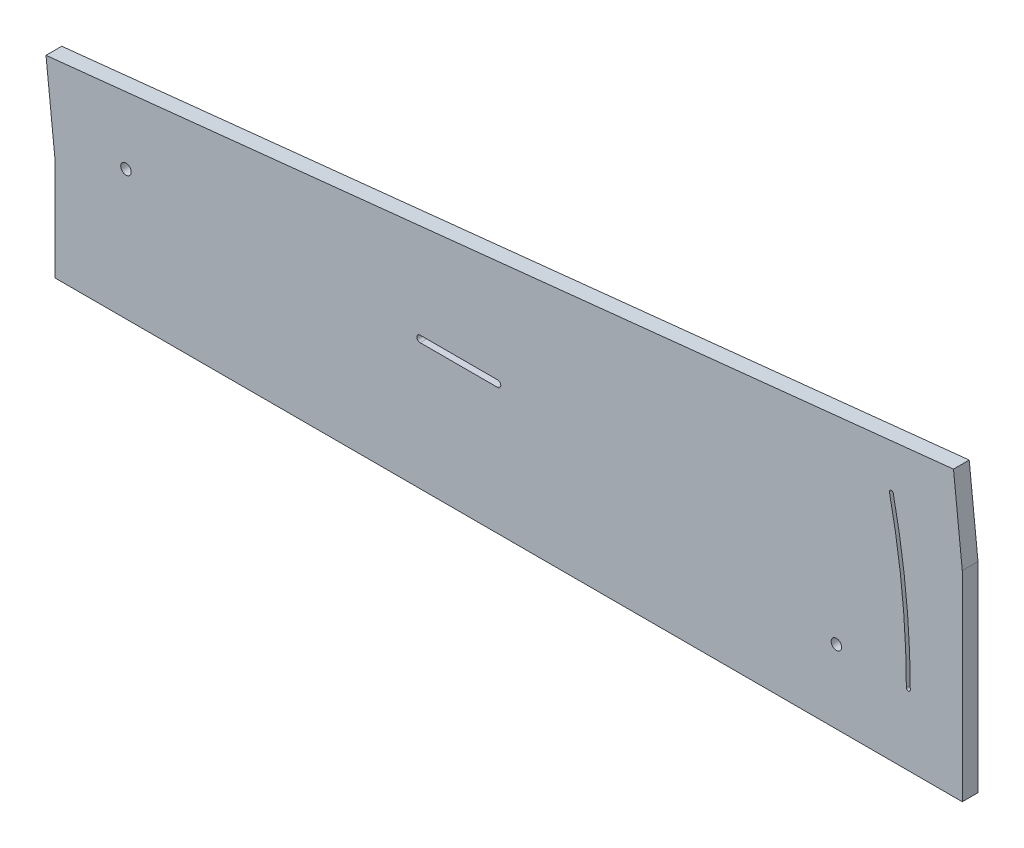
from build123d import *

# Parameters (mm, degrees)
BOSS_EXTRUDE1_DEPTH = 19.05
SKETCH8_R           = 6.35
CUT_EXTRUDE3_DEPTH  = 1152.453768969
CUT_EXTRUDE4_DEPTH  = 1152.453768969
SKETCH10_R          = 6.35
CUT_EXTRUDE5_DEPTH  = 1152.453768969


with BuildPart() as part:
    # Sketch1 → Boss-Extrude1 (new body)
    with BuildSketch(Plane.XY):
        Polygon((-10.620091868, 228.043424569), (1088.227150324, 343.536923634), (1098.847242192, 242.493499064), (1098.847242192, 0), (0, 0), (0, 127), align=None)
    extrude(amount=BOSS_EXTRUDE1_DEPTH)

    # Sketch8 → Cut-Extrude3 (cut, through all)
    with BuildSketch(Plane.XY.offset(19.05)):
        with Locations((86.197214357, 157.1625)):
            Circle(SKETCH8_R)
        with BuildLine():
            Line((442.415992192, 161.13125), (536.078492192, 161.13125))
            ThreePointArc((536.078492192, 161.13125), (540.047242192, 157.1625), (536.078492192, 153.19375))
            Line((536.078492192, 153.19375), (442.415992192, 153.19375))
            ThreePointArc((442.415992192, 153.19375), (438.447242192, 157.1625), (442.415992192, 161.13125))
        make_face()
    extrude(amount=-CUT_EXTRUDE3_DEPTH, mode=Mode.SUBTRACT)

    # Sketch9 → Cut-Extrude4 (cut, through all)
    with BuildSketch(Plane.XY.offset(19.05)):
        with BuildLine():
            ThreePointArc((1035.904292432, 85.7708681), (1030.742924963, 184.255626282), (1015.315371576, 281.661364844))
            ThreePointArc((1015.315371576, 281.661364844), (1012.491067888, 283.495489105), (1010.656943627, 280.671185417))
            ThreePointArc((1010.656943627, 280.671185417), (1026.006514436, 183.757809476), (1031.141792432, 85.7708681))
            ThreePointArc((1031.141792432, 85.7708681), (1033.523042432, 83.3896181), (1035.904292432, 85.7708681))
        make_face()
    extrude(amount=-CUT_EXTRUDE4_DEPTH, mode=Mode.SUBTRACT)

    # Sketch10 → Cut-Extrude5 (cut, through all)
    with BuildSketch(Plane.XY.offset(19.05)):
        with Locations((946.447242192, 88.9)):
            Circle(SKETCH10_R)
    extrude(amount=-CUT_EXTRUDE5_DEPTH, mode=Mode.SUBTRACT)


solid = part.part
